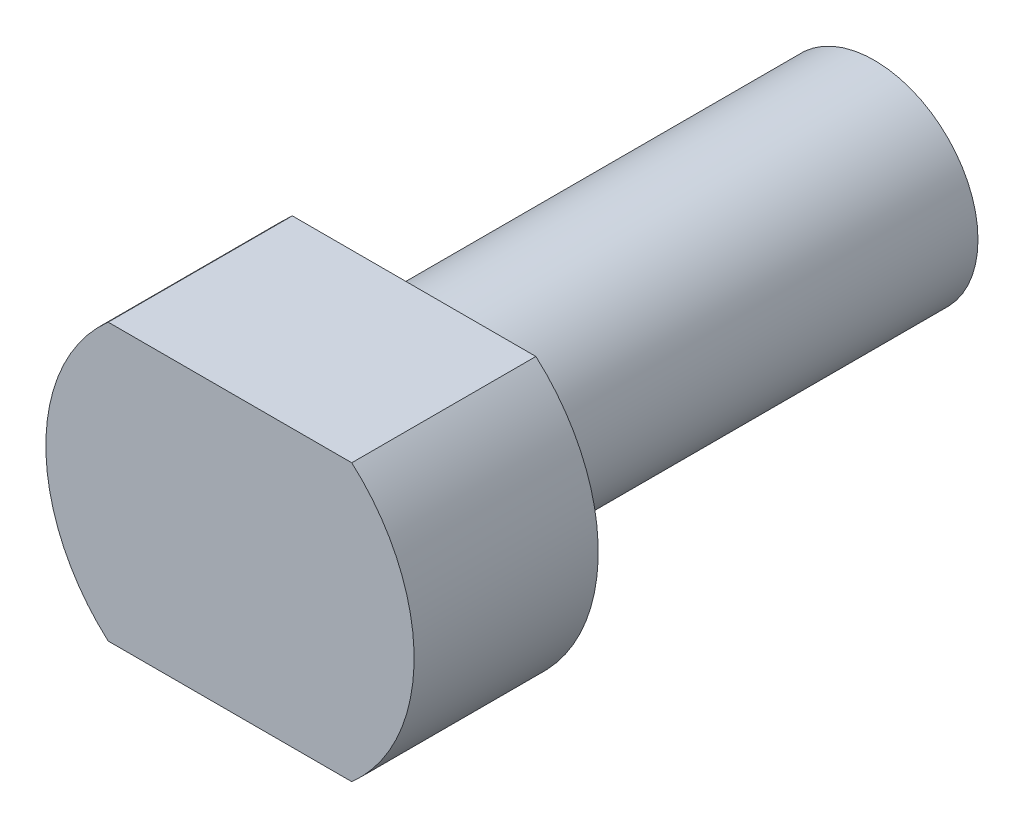
from build123d import *

# Parameters (mm, degrees)
SKETCH1_R           = 2.25
BOSS_EXTRUDE1_DEPTH = 10
SKETCH2_R           = 4
BOSS_EXTRUDE2_DEPTH = 4
CUT_EXTRUDE1_START  = -4
CUT_EXTRUDE1_DEPTH  = 4


with BuildPart() as part:
    # Sketch1 → Boss-Extrude1 (new body)
    with BuildSketch(Plane.XY):
        Circle(SKETCH1_R)
    extrude(amount=BOSS_EXTRUDE1_DEPTH)

    # Sketch2 → Boss-Extrude2 (add)
    with BuildSketch(Plane.XY.offset(10)):
        Circle(SKETCH2_R)
    extrude(amount=BOSS_EXTRUDE2_DEPTH)

    # Sketch3 → Cut-Extrude1 (cut)
    with BuildSketch(Plane.XY.offset(14).offset(CUT_EXTRUDE1_START)):
        with BuildLine():
            Line((-2.645751311, 3), (2.645751311, 3))
            ThreePointArc((2.645751311, 3), (0, 4), (-2.645751311, 3))
        make_face()
        with BuildLine():
            Line((-2.645751311, -3), (2.645751311, -3))
            ThreePointArc((2.645751311, -3), (0, -4), (-2.645751311, -3))
        make_face()
    extrude(amount=CUT_EXTRUDE1_DEPTH, mode=Mode.SUBTRACT)


solid = part.part
